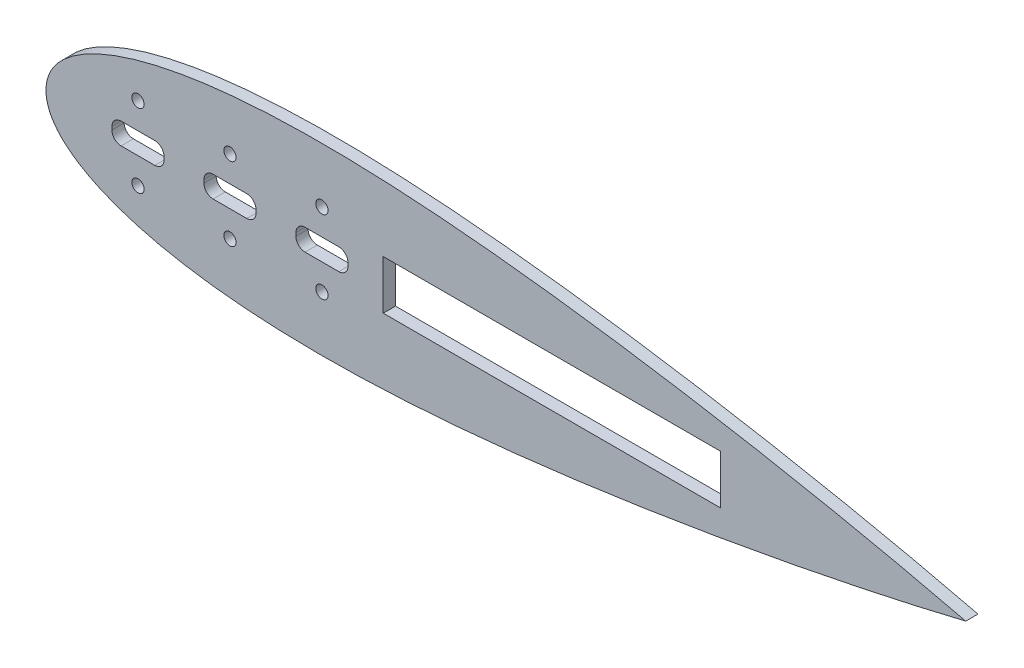
from build123d import *

# Parameters (mm, degrees)
SKETCH_1_R      = 2
SKETCH_1_W      = 110
SKETCH_1_H      = 16
EXTRUDE_1_DEPTH = 4


with BuildPart() as part:
    # 草图1 → 凸台-拉伸1 (new body)
    with BuildSketch(Plane.XY):
        with BuildLine():
            add(Edge.make_bspline(
                [(0, 0), (-0.00021229, 0.506970744), (0.044864754, 1.381714413), (0.226017079, 2.650839475), (0.688025344, 4.299952552), (1.335546305, 5.873041675), (2.26695445, 7.542579189), (3.571946964, 9.346109572), (5.391381815, 11.324673938), (7.954469743, 13.539518757), (11.584975672, 16.021510412), (16.648123966, 18.726988569), (23.793189999, 21.649781435), (33.085765079, 24.436937203), (46.643058908, 27.284493785), (64.063199307, 29.362693495), (84.450847037, 30.260343335), (107.414943041, 29.859960777), (130.332556147, 28.428346139), (153.186136376, 26.214758658), (175.970846287, 23.391654718), (195.848592789, 20.487628812), (212.844945694, 17.732999103), (226.980485609, 15.27094618), (238.271313866, 13.203878393), (248.135151077, 11.310105462), (256.577305747, 9.625486685), (263.604664912, 8.179483676), (269.219788458, 6.997398786), (274.1309907, 5.93944771), (278.331979904, 5.017052178), (281.838528118, 4.234963306), (284.626645762, 3.606112196), (287.446648095, 2.96209323), (290.200347561, 2.326575377), (293.076089097, 1.653806717), (295.700233888, 1.034172197), (298.078453529, 0.464134201), (299.36547076, 0.153714708), (299.999999999, 0)],
                knots=[0, 0, 0, 0, 0, 0.005874531, 0.010168378, 0.014828146, 0.019835444, 0.025574736, 0.032308878, 0.040609511, 0.050966894, 0.064812119, 0.083253248, 0.107120705, 0.140429682, 0.177263566, 0.243881637, 0.310499708, 0.377117784, 0.443735861, 0.510353937, 0.576972013, 0.643590091, 0.67689913, 0.710208169, 0.743517207, 0.776826246, 0.793480766, 0.810135286, 0.826789806, 0.843444325, 0.851771585, 0.860098845, 0.868426105, 0.876753365, 0.885080625, 0.893407884, 0.901735144, 0.910062404, 0.910062404, 0.910062404, 0.910062404, 0.910062404], degree=4))
            add(Edge.make_bspline(
                [(0, 0), (-0.00021229, -0.506970744), (0.044864754, -1.381714413), (0.226017079, -2.650839475), (0.688025344, -4.299952552), (1.335546305, -5.873041675), (2.26695445, -7.542579189), (3.571946964, -9.346109572), (5.391381815, -11.324673938), (7.954469743, -13.539518757), (11.584975672, -16.021510412), (16.648123966, -18.726988569), (23.793189999, -21.649781435), (33.085765079, -24.436937203), (46.643058908, -27.284493785), (64.063199307, -29.362693495), (84.450847037, -30.260343335), (107.414943041, -29.859960777), (130.332556147, -28.428346139), (153.186136376, -26.214758658), (175.970846287, -23.391654718), (195.848592789, -20.487628812), (212.844945694, -17.732999103), (226.980485609, -15.27094618), (238.271313866, -13.203878393), (248.135151077, -11.310105462), (256.577305747, -9.625486685), (263.604664912, -8.179483676), (269.219788458, -6.997398786), (274.1309907, -5.93944771), (278.331979904, -5.017052178), (281.838528118, -4.234963306), (284.626645762, -3.606112196), (287.446648095, -2.96209323), (290.200347561, -2.326575377), (293.076089097, -1.653806717), (295.700233888, -1.034172197), (298.078453528, -0.464134202), (299.36547076, -0.153714708), (299.999999999, 0)],
                knots=[0, 0, 0, 0, 0, 0.005874531, 0.010168378, 0.014828146, 0.019835444, 0.025574736, 0.032308878, 0.040609511, 0.050966894, 0.064812119, 0.083253248, 0.107120705, 0.140429682, 0.177263566, 0.243881637, 0.310499708, 0.377117784, 0.443735861, 0.510353937, 0.576972013, 0.643590091, 0.67689913, 0.710208169, 0.743517207, 0.776826246, 0.793480766, 0.810135286, 0.826789806, 0.843444325, 0.851771585, 0.860098845, 0.868426105, 0.876753365, 0.885080625, 0.893407884, 0.901735144, 0.910062404, 0.910062404, 0.910062404, 0.910062404, 0.910062404], degree=4))
        make_face()
        with Locations((30, 12)):
            Circle(SKETCH_1_R, mode=Mode.SUBTRACT)
        with Locations((30, -12)):
            Circle(SKETCH_1_R, mode=Mode.SUBTRACT)
        with Locations((60, 12)):
            Circle(SKETCH_1_R, mode=Mode.SUBTRACT)
        with Locations((60, -12)):
            Circle(SKETCH_1_R, mode=Mode.SUBTRACT)
        with Locations((90, 12)):
            Circle(SKETCH_1_R, mode=Mode.SUBTRACT)
        with Locations((90, -12)):
            Circle(SKETCH_1_R, mode=Mode.SUBTRACT)
        with BuildLine():
            Line((54.5, 3.5), (65.5, 3.5))
            ThreePointArc((65.5, 3.5), (67.621320344, 2.621320344), (68.5, 0.5))
            Line((68.5, 0.5), (68.5, -0.5))
            ThreePointArc((68.5, -0.5), (67.621320344, -2.621320344), (65.5, -3.5))
            Line((65.5, -3.5), (54.5, -3.5))
            ThreePointArc((54.5, -3.5), (52.378679656, -2.621320344), (51.5, -0.5))
            Line((51.5, -0.5), (51.5, 0.5))
            ThreePointArc((51.5, 0.5), (52.378679656, 2.621320344), (54.5, 3.5))
        make_face(mode=Mode.SUBTRACT)
        with BuildLine():
            Line((24.5, 3.5), (35.5, 3.5))
            ThreePointArc((35.5, 3.5), (37.621320344, 2.621320344), (38.5, 0.5))
            Line((38.5, 0.5), (38.5, -0.5))
            ThreePointArc((38.5, -0.5), (37.621320344, -2.621320344), (35.5, -3.5))
            Line((35.5, -3.5), (24.5, -3.5))
            ThreePointArc((24.5, -3.5), (22.378679656, -2.621320344), (21.5, -0.5))
            Line((21.5, -0.5), (21.5, 0.5))
            ThreePointArc((21.5, 0.5), (22.378679656, 2.621320344), (24.5, 3.5))
        make_face(mode=Mode.SUBTRACT)
        with BuildLine():
            Line((84.5, 3.5), (95.5, 3.5))
            ThreePointArc((95.5, 3.5), (97.621320344, 2.621320344), (98.5, 0.5))
            Line((98.5, 0.5), (98.5, -0.5))
            ThreePointArc((98.5, -0.5), (97.621320344, -2.621320344), (95.5, -3.5))
            Line((95.5, -3.5), (84.5, -3.5))
            ThreePointArc((84.5, -3.5), (82.378679656, -2.621320344), (81.5, -0.5))
            Line((81.5, -0.5), (81.5, 0.5))
            ThreePointArc((81.5, 0.5), (82.378679656, 2.621320344), (84.5, 3.5))
        make_face(mode=Mode.SUBTRACT)
        with Locations((165, 0)):
            Rectangle(SKETCH_1_W, SKETCH_1_H, mode=Mode.SUBTRACT)
    extrude(amount=EXTRUDE_1_DEPTH)


solid = part.part
